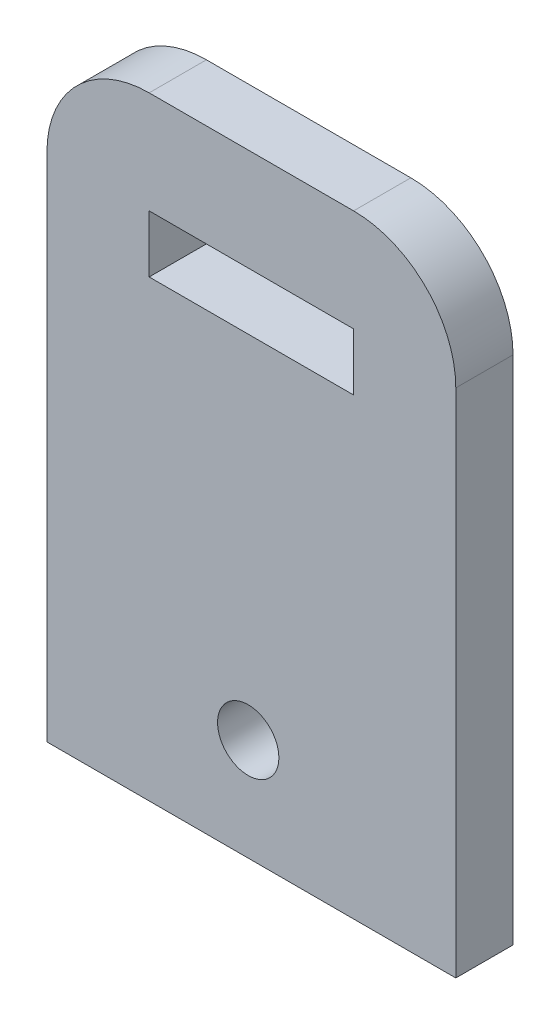
from build123d import *

# Parameters (mm, degrees)
MODEL_R             = 1.5
BOSS_EXTRUDE1_DEPTH = 2.8


with BuildPart() as part:
    # Model → Boss-Extrude1 (new body)
    with BuildSketch(Plane.XY):
        with BuildLine():
            Line((91.882047895, -12.427518263), (111.882047895, -12.427518263))
            Line((111.882047895, -12.427518263), (111.882047895, -2.427518263))
            Line((111.882047895, -2.427518263), (111.882047895, 12.572481737))
            ThreePointArc((111.882047895, 12.572481737), (110.417581801, 16.108015643), (106.882047895, 17.572481737))
            Line((106.882047895, 17.572481737), (96.882047895, 17.572481737))
            ThreePointArc((96.882047895, 17.572481737), (93.346513989, 16.108015643), (91.882047895, 12.572481737))
            Line((91.882047895, 12.572481737), (91.882047895, -2.427518263))
            Line((91.882047895, -2.427518263), (91.882047895, -12.427518263))
        make_face()
        with Locations((101.727306447, -7.427518263)):
            Circle(MODEL_R, mode=Mode.SUBTRACT)
        Polygon((101.882047895, 12.572481737), (96.882047895, 12.572481737), (96.882047895, 9.772481737), (106.882047895, 9.772481737), (106.882047895, 12.572481737), align=None, mode=Mode.SUBTRACT)
    extrude(amount=BOSS_EXTRUDE1_DEPTH)


solid = part.part
